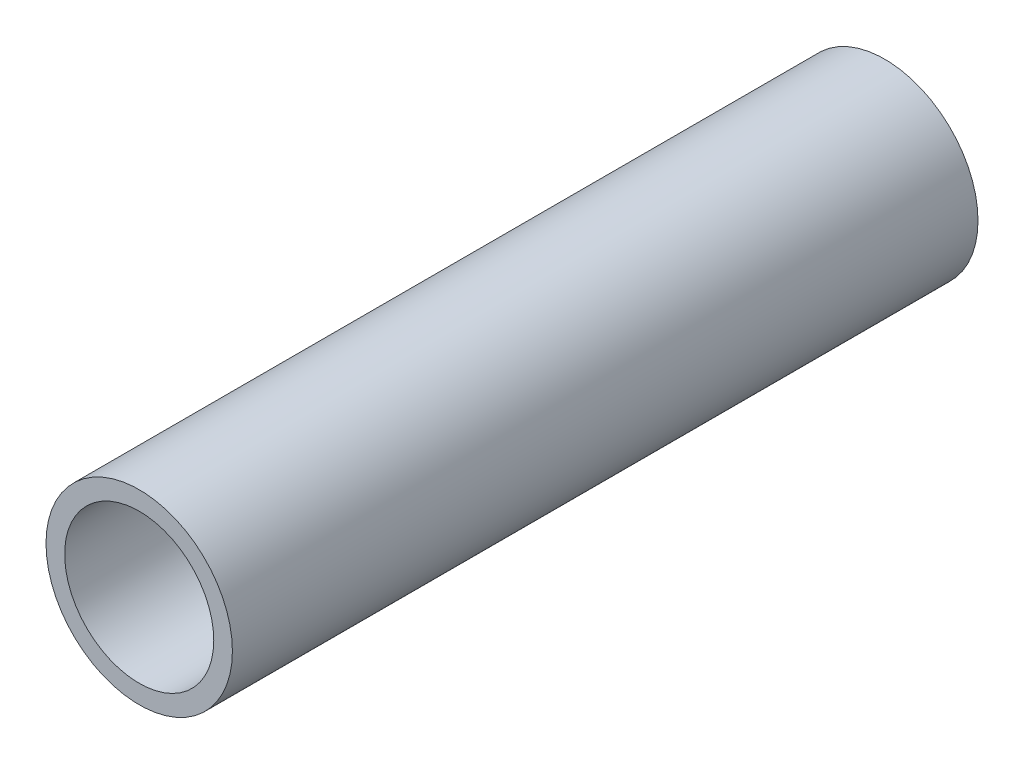
from build123d import *

# Parameters (mm, degrees)
SKETCH1_R           = 5
SKETCH1_R_2         = 4
BOSS_EXTRUDE1_DEPTH = 40


with BuildPart() as part:
    # Sketch1 → Boss-Extrude1 (new body)
    with BuildSketch(Plane.XY):
        Circle(SKETCH1_R)
        Circle(SKETCH1_R_2, mode=Mode.SUBTRACT)
    extrude(amount=BOSS_EXTRUDE1_DEPTH)


solid = part.part
